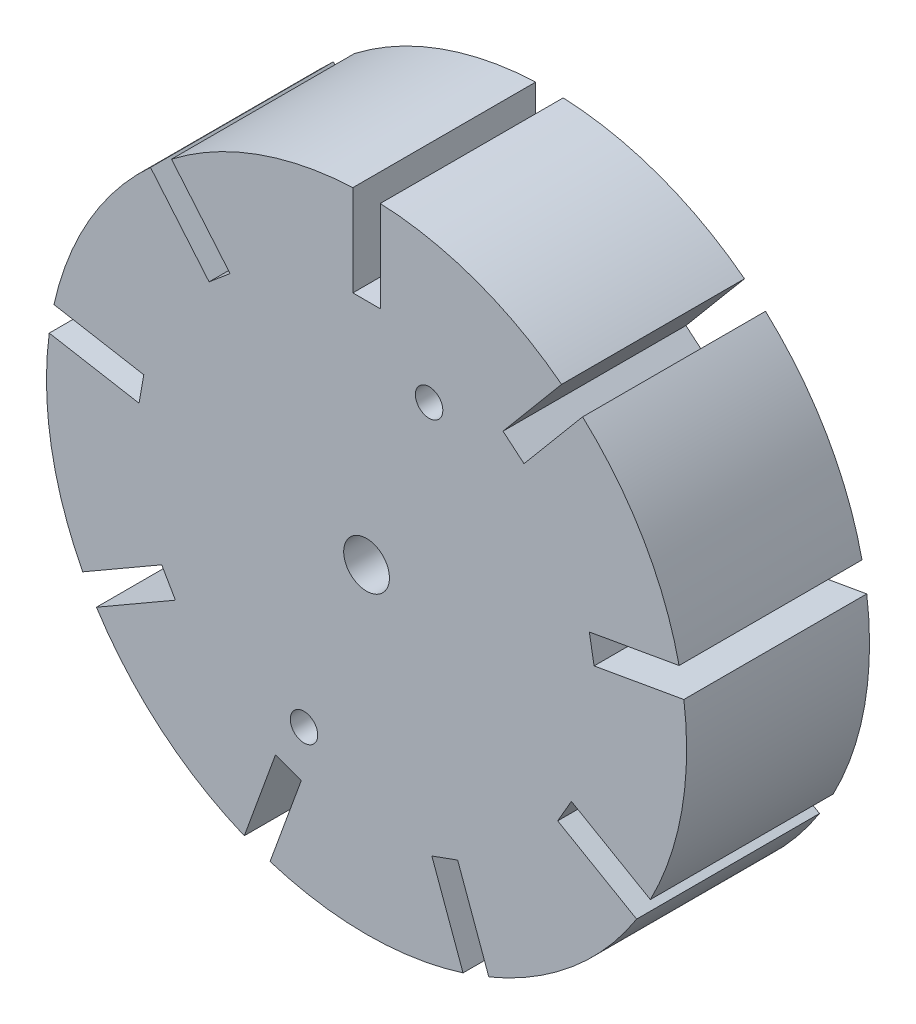
from build123d import *

# Parameters (mm, degrees)
SKETCH_1_R               = 35
SKETCH_1_R_2             = 2.5
EXTRUDE_1_DEPTH          = 20
CUT_EXTRUDE_START        = -20
CUT_EXTRUDE_1_DEPTH      = 20
PATTERN_CIRCULAR_1_COUNT = 9
SKETCH_3_R               = 1.5
CUT_EXTRUDE_2_DEPTH      = 20


with BuildPart() as part:
    # 草图1 → 凸台-拉伸1 (new body)
    with BuildSketch(Plane.XY):
        Circle(SKETCH_1_R)
        Circle(SKETCH_1_R_2, mode=Mode.SUBTRACT)
    extrude(amount=EXTRUDE_1_DEPTH)

    # 草图2 → 切除-拉伸1 (cut)
    with BuildSketch(Plane.XY.offset(20).offset(CUT_EXTRUDE_START)):
        with BuildLine():
            Line((-1.5, 25), (1.5, 25))
            Line((1.5, 25), (1.5, 34.96784237))
            ThreePointArc((1.5, 34.96784237), (0, 35), (-1.5, 34.96784237))
            Line((-1.5, 34.96784237), (-1.5, 25))
        make_face()
    cut_extrude_1 = extrude(amount=CUT_EXTRUDE_1_DEPTH, mode=Mode.SUBTRACT)

    # 阵列(圆周)1: 切除-拉伸1 ×9 about axis
    pattern_circular_1_axis = Axis((0, 0, 0), (0, 0, 1))
    for i in range(1, PATTERN_CIRCULAR_1_COUNT):
        add(cut_extrude_1.rotate(pattern_circular_1_axis, i * 360 / PATTERN_CIRCULAR_1_COUNT), mode=Mode.SUBTRACT)

    # 草图3 → 切除-拉伸2 (cut)
    with BuildSketch(Plane.XY.offset(20)):
        with Locations((6.840402867, 18.793852416)):
            Circle(SKETCH_3_R)
        with Locations((-6.840402867, -18.793852416)):
            Circle(SKETCH_3_R)
    extrude(amount=-CUT_EXTRUDE_2_DEPTH, mode=Mode.SUBTRACT)


solid = part.part
